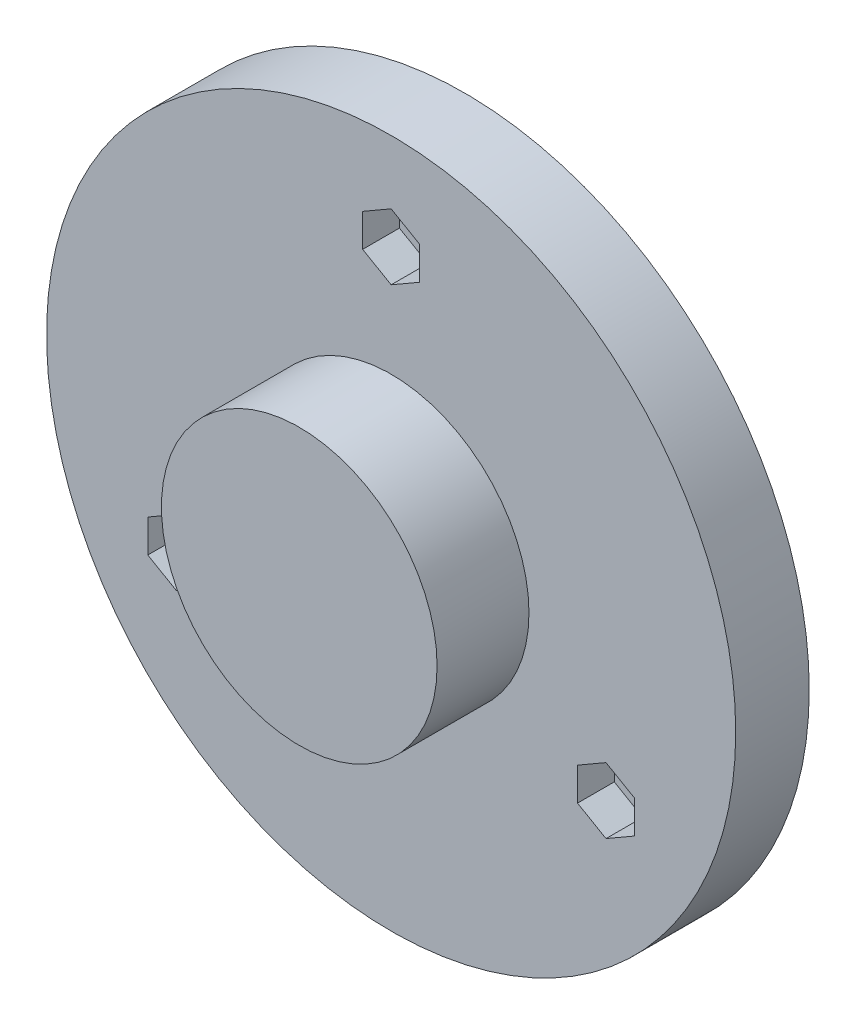
from build123d import *

# Parameters (mm, degrees)
SKETCH2_R           = 37.5
BOSS_EXTRUDE1_DEPTH = 8
CUT_EXTRUDE1_DEPTH  = 4
CIRPATTERN1_COUNT   = 3
CUT_EXTRUDE2_DEPTH  = 17
CIRPATTERN2_COUNT   = 3
SKETCH6_R           = 15
BOSS_EXTRUDE2_DEPTH = 10


with BuildPart() as part:
    # Sketch2 → Boss-Extrude1 (new body)
    with BuildSketch(Plane.XY):
        Circle(SKETCH2_R)
    extrude(amount=BOSS_EXTRUDE1_DEPTH)

    # Sketch3 → Cut-Extrude1 (cut)
    with BuildSketch(Plane.XY.offset(8)):
        Polygon((0, 23.42), (3.100370946, 25.21), (3.100370946, 28.79), (0, 30.58), (-3.100370946, 28.79), (-3.100370946, 25.21), align=None)
    cut_extrude1 = extrude(amount=-CUT_EXTRUDE1_DEPTH, mode=Mode.SUBTRACT)

    # CirPattern1: Cut-Extrude1 ×3 about axis
    cirpattern1_axis = Axis((0, 0, 0), (0, 0, 1))
    for i in range(1, CIRPATTERN1_COUNT):
        add(cut_extrude1.rotate(cirpattern1_axis, i * 360 / CIRPATTERN1_COUNT), mode=Mode.SUBTRACT)

    # Sketch5 → Cut-Extrude2 (cut)
    with BuildSketch(Plane.XY.offset(4)):
        with BuildLine():
            ThreePointArc((1.515544457, 27.875), (-0.875, 28.515544457), (-1.515544457, 26.125))
            Line((-1.515544457, 26.125), (1.515544457, 27.875))
        make_face()
        with BuildLine():
            Line((1.515544457, 27.875), (-1.515544457, 26.125))
            ThreePointArc((-1.515544457, 26.125), (0.452933329, 25.309629804), (1.75, 27))
            ThreePointArc((1.75, 27), (1.690370196, 27.452933329), (1.515544457, 27.875))
        make_face()
    cut_extrude2 = extrude(amount=-CUT_EXTRUDE2_DEPTH, mode=Mode.SUBTRACT)

    # CirPattern2: Cut-Extrude2 ×3 about axis
    cirpattern2_axis = Axis((0, 0, 0), (0, 0, 1))
    for i in range(1, CIRPATTERN2_COUNT):
        add(cut_extrude2.rotate(cirpattern2_axis, i * 360 / CIRPATTERN2_COUNT), mode=Mode.SUBTRACT)

    # Sketch6 → Boss-Extrude2 (add)
    with BuildSketch(Plane.XY.offset(8)):
        Circle(SKETCH6_R)
    extrude(amount=BOSS_EXTRUDE2_DEPTH)


solid = part.part
